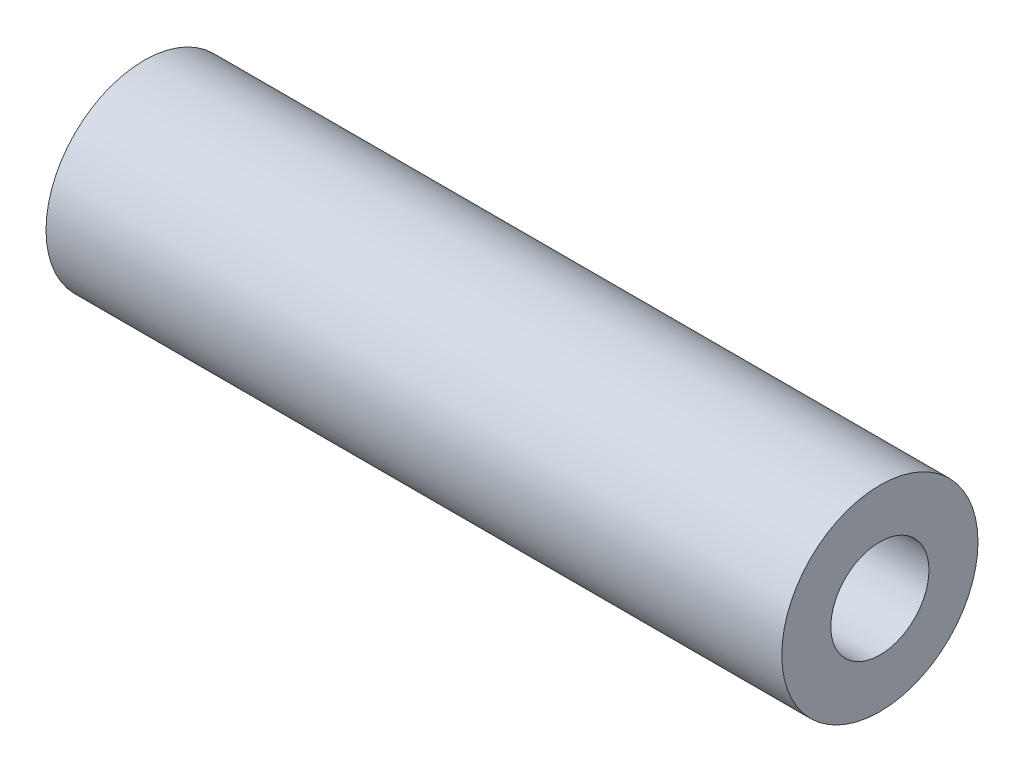
from build123d import *

# Parameters (mm, degrees)
SKETCH1_R           = 6.35
SKETCH1_R_2         = 3.175
BOSS_EXTRUDE1_DEPTH = 47.625


with BuildPart() as part:
    # Sketch1 → Boss-Extrude1 (new body)
    with BuildSketch(Plane(origin=(0, 0, 0), x_dir=(0, 0, -1), z_dir=(1, 0, 0))):
        Circle(SKETCH1_R)
        Circle(SKETCH1_R_2, mode=Mode.SUBTRACT)
    extrude(amount=BOSS_EXTRUDE1_DEPTH)


solid = part.part
